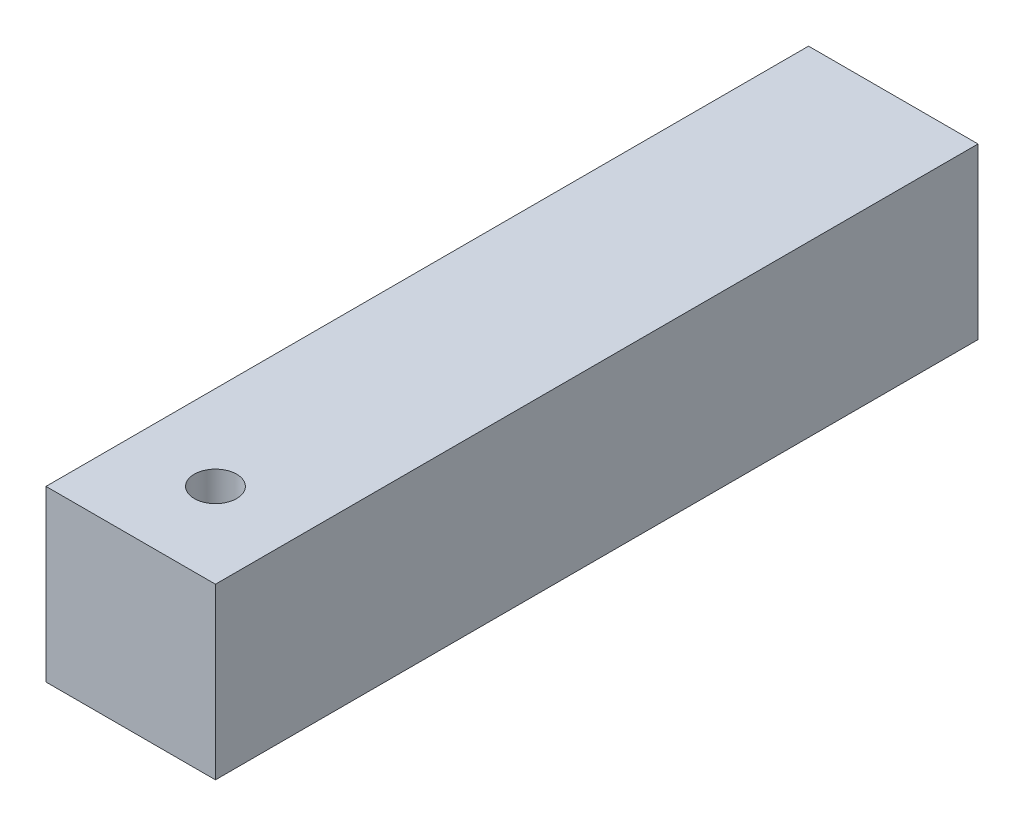
from build123d import *

# Parameters (mm, degrees)
SKETCH2_W           = 100
SKETCH2_H           = 100
BOSS_EXTRUDE1_DEPTH = 450
SKETCH3_R           = 12.5
CUT_EXTRUDE1_DEPTH  = 500


with BuildPart() as part:
    # Sketch2 → Boss-Extrude1 (new body)
    with BuildSketch(Plane.XY):
        Rectangle(SKETCH2_W, SKETCH2_H)
    extrude(amount=-BOSS_EXTRUDE1_DEPTH)

    # Sketch3 → Cut-Extrude1 (cut)
    with BuildSketch(Plane(origin=(0, 50, 0), x_dir=(1, 0, 0), z_dir=(0, 1, 0))):
        with Locations(Location((0, 50, 0), (0, 0, 180))):
            Circle(SKETCH3_R)
    extrude(amount=-CUT_EXTRUDE1_DEPTH, mode=Mode.SUBTRACT)


solid = part.part
